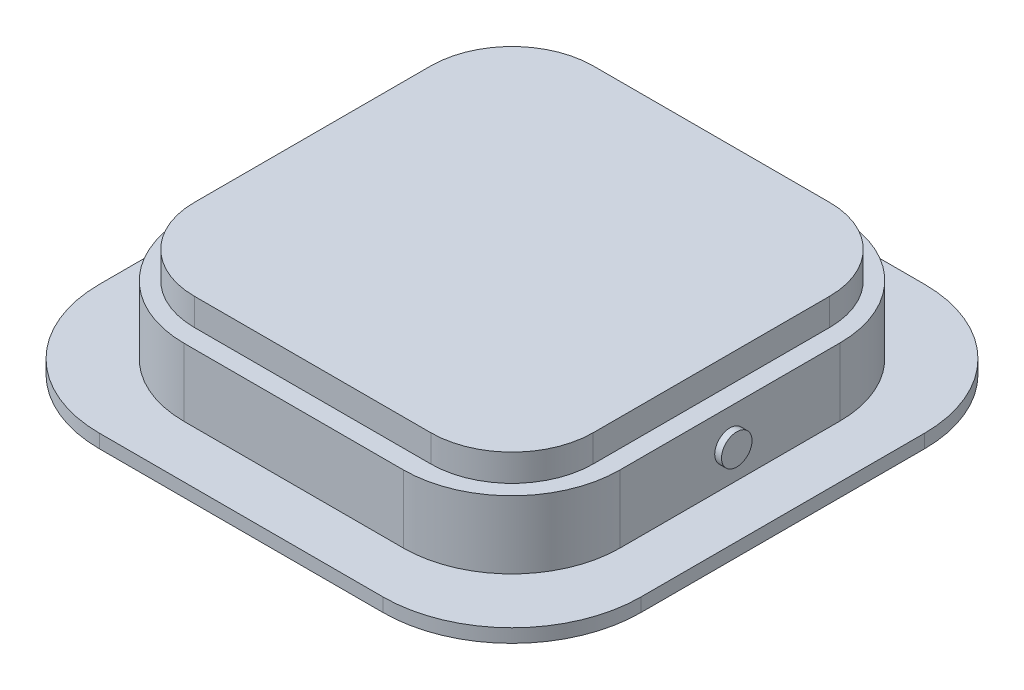
from build123d import *

# Parameters (mm, degrees)
BOSS_EXTRUDE1_DEPTH = 2
BOSS_EXTRUDE2_DEPTH = 5
BOSS_EXTRUDE3_DEPTH = 1
BOSS_EXTRUDE4_DEPTH = 2.5
SKETCH5_R           = 1.127617125
BOSS_EXTRUDE5_DEPTH = 0.5


with BuildPart() as part:
    # Sketch1 → Boss-Extrude1 (new body)
    with BuildSketch(Plane(origin=(0, 0, 0), x_dir=(1, 0, 0), z_dir=(0, 1, 0))):
        with BuildLine():
            Line((8.732, -14.732), (-8.732, -14.732))
            ThreePointArc((-8.732, -14.732), (-12.974640687, -12.974640687), (-14.732, -8.732))
            Line((-14.732, -8.732), (-14.732, 8.732))
            ThreePointArc((-14.732, 8.732), (-12.974640687, 12.974640687), (-8.732, 14.732))
            Line((-8.732, 14.732), (8.732, 14.732))
            ThreePointArc((8.732, 14.732), (12.974640687, 12.974640687), (14.732, 8.732))
            Line((14.732, 8.732), (14.732, -8.732))
            ThreePointArc((14.732, -8.732), (12.974640687, -12.974640687), (8.732, -14.732))
        make_face()
    extrude(amount=BOSS_EXTRUDE1_DEPTH)

    # Sketch2 → Boss-Extrude2 (add)
    with BuildSketch(Plane.XZ):
        with BuildLine():
            Line((8.1, -16.122288114), (-8.1, -16.122288114))
            ThreePointArc((-8.1, -16.122288114), (-13.756854249, -13.779142364), (-16.1, -8.122288114))
            Line((-16.1, -8.122288114), (-16.1, 8.122288114))
            ThreePointArc((-16.1, 8.122288114), (-13.756854249, 13.779142364), (-8.1, 16.122288114))
            Line((-8.1, 16.122288114), (8.1, 16.122288114))
            ThreePointArc((8.1, 16.122288114), (13.756854249, 13.779142364), (16.1, 8.122288114))
            Line((16.1, 8.122288114), (16.1, -8.122288114))
            ThreePointArc((16.1, -8.122288114), (13.756854249, -13.779142364), (8.1, -16.122288114))
        make_face()
    extrude(amount=BOSS_EXTRUDE2_DEPTH)

    # Sketch3 → Boss-Extrude3 (add)
    with BuildSketch(Plane.XZ.offset(5)):
        with BuildLine():
            Line((10.47496, -20), (-10.47496, -20))
            ThreePointArc((-10.47496, -20), (-17.210152091, -17.210192091), (-19.99996, -10.475))
            Line((-19.99996, -10.475), (-19.99996, 10.475))
            ThreePointArc((-19.99996, 10.475), (-17.210152091, 17.210192091), (-10.47496, 20))
            Line((-10.47496, 20), (10.47496, 20))
            ThreePointArc((10.47496, 20), (17.210152091, 17.210192091), (19.99996, 10.475))
            Line((19.99996, 10.475), (19.99996, -10.475))
            ThreePointArc((19.99996, -10.475), (17.210152091, -17.210192091), (10.47496, -20))
        make_face()
    extrude(amount=BOSS_EXTRUDE3_DEPTH)

    # Sketch4 → Boss-Extrude4 (add)
    with BuildSketch(Plane.XZ.offset(6)):
        with BuildLine():
            Line((9.5, -13.25), (-9.5, -13.25))
            ThreePointArc((-9.5, -13.25), (-11.621320344, -12.371320344), (-12.5, -10.25))
            Line((-12.5, -10.25), (-12.5, 10.25))
            ThreePointArc((-12.5, 10.25), (-11.621320344, 12.371320344), (-9.5, 13.25))
            Line((-9.5, 13.25), (9.5, 13.25))
            ThreePointArc((9.5, 13.25), (11.621320344, 12.371320344), (12.5, 10.25))
            Line((12.5, 10.25), (12.5, -10.25))
            ThreePointArc((12.5, -10.25), (11.621320344, -12.371320344), (9.5, -13.25))
        make_face()
    extrude(amount=BOSS_EXTRUDE4_DEPTH)

    # Sketch5 → Boss-Extrude5 (add)
    with BuildSketch(Plane(origin=(16.1, 0, 0), x_dir=(0, 0, -1), z_dir=(1, 0, 0))):
        with Locations(Location((0, -2.5, 0), (0, 0, 180))):
            Circle(SKETCH5_R)
    extrude(amount=BOSS_EXTRUDE5_DEPTH)


solid = part.part
